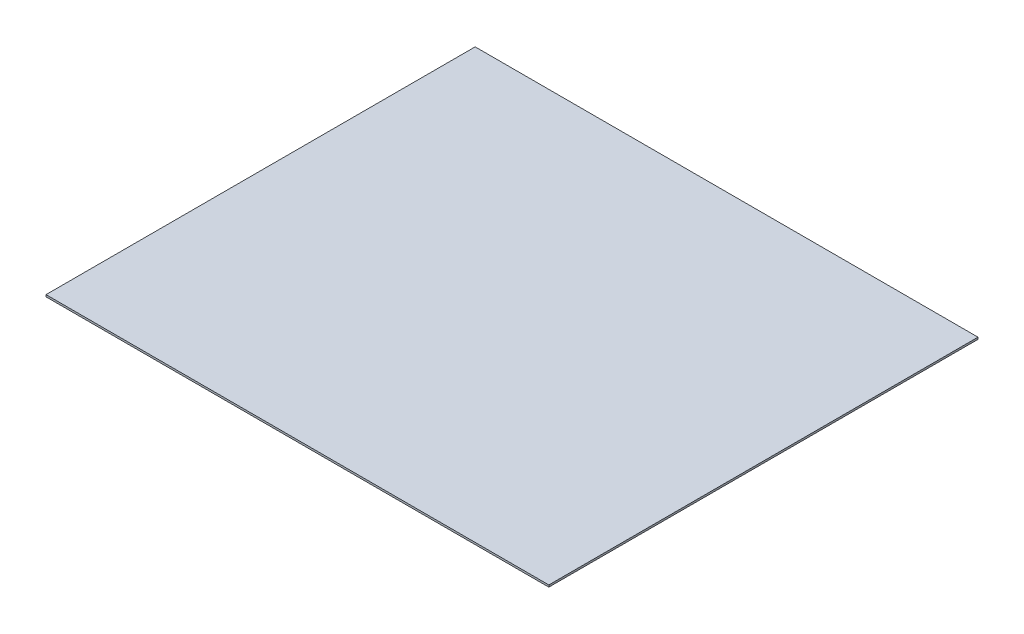
from build123d import *

# Parameters (mm, degrees)
SKETCH1_W           = 662.94
SKETCH1_H           = 565.810000204
BOSS_EXTRUDE1_DEPTH = 2.54


with BuildPart() as part:
    # Sketch1 → Boss-Extrude1 (new body)
    with BuildSketch(Plane(origin=(0, 0, 0), x_dir=(1, 0, 0), z_dir=(0, 1, 0))):
        with Locations((331.47, 282.905000102)):
            Rectangle(SKETCH1_W, SKETCH1_H)
    extrude(amount=BOSS_EXTRUDE1_DEPTH)


solid = part.part
